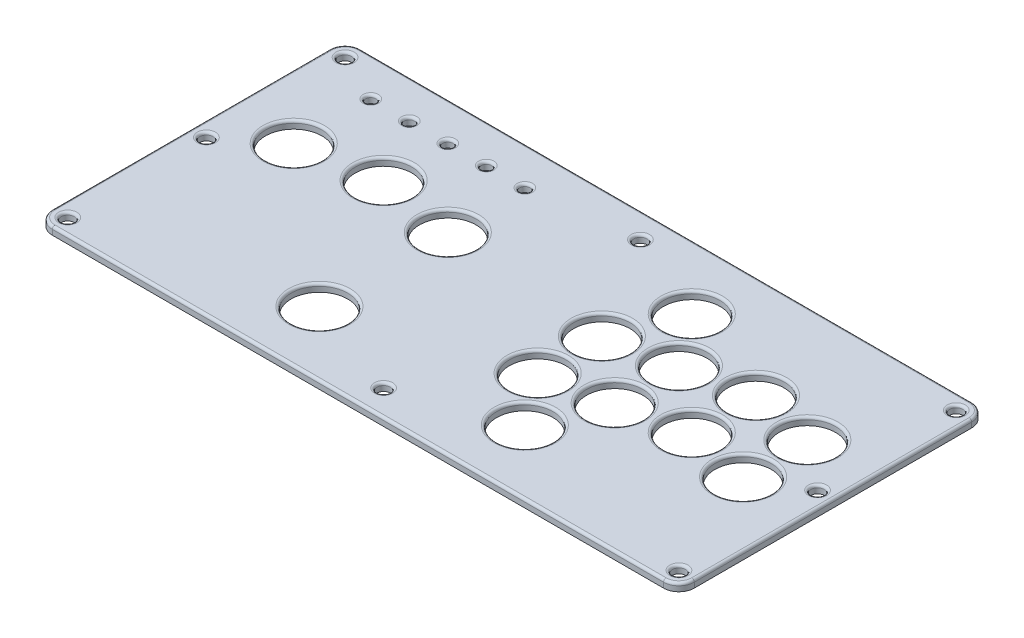
from build123d import *

# Parameters (mm, degrees)
SKETCH_1_R      = 2.55
SKETCH_1_R_2    = 11
SKETCH_1_R_3    = 2
EXTRUDE_1_DEPTH = 3
FILLET_1_R      = 1


with BuildPart() as part:
    # 草图1 → 凸台-拉伸1 (new body)
    with BuildSketch(Plane(origin=(0, 0, 0), x_dir=(1, 0, 0), z_dir=(0, 1, 0))):
        with BuildLine():
            Line((18.99899992, 127.363794239), (256.99899992, 127.363794239))
            ThreePointArc((256.99899992, 127.363794239), (261.241640607, 125.606434926), (262.99899992, 121.363794239))
            Line((262.99899992, 121.363794239), (262.99899992, 13.363794239))
            ThreePointArc((262.99899992, 13.363794239), (261.241640607, 9.121153552), (256.99899992, 7.363794239))
            Line((256.99899992, 7.363794239), (18.99899992, 7.363794239))
            ThreePointArc((18.99899992, 7.363794239), (14.756359233, 9.121153552), (12.99899992, 13.363794239))
            Line((12.99899992, 13.363794239), (12.99899992, 121.363794239))
            ThreePointArc((12.99899992, 121.363794239), (14.756359233, 125.606434926), (18.99899992, 127.363794239))
        make_face()
        with Locations(Location((18.99899992, 121.363794239, 0), (0, 0, 270))):
            Circle(SKETCH_1_R, mode=Mode.SUBTRACT)
        with Locations(Location((256.99899992, 121.363794239, 0), (0, 0, 270))):
            Circle(SKETCH_1_R, mode=Mode.SUBTRACT)
        with Locations(Location((137.99899992, 117.363794239, 0), (0, 0, 270))):
            Circle(SKETCH_1_R, mode=Mode.SUBTRACT)
        with Locations(Location((18.99899992, 13.363794239, 0), (0, 0, 270))):
            Circle(SKETCH_1_R, mode=Mode.SUBTRACT)
        with Locations(Location((256.99899992, 13.363794239, 0), (0, 0, 270))):
            Circle(SKETCH_1_R, mode=Mode.SUBTRACT)
        with Locations(Location((137.99899992, 17.363794239, 0), (0, 0, 270))):
            Circle(SKETCH_1_R, mode=Mode.SUBTRACT)
        with Locations(Location((256.99899992, 67.363794239, 0), (0, 0, 270))):
            Circle(SKETCH_1_R, mode=Mode.SUBTRACT)
        with Locations(Location((18.99899992, 67.363794239, 0), (0, 0, 270))):
            Circle(SKETCH_1_R, mode=Mode.SUBTRACT)
        with Locations(Location((162.99899992, 77.363794239, 0), (0, 0, 270))):
            Circle(SKETCH_1_R_2, mode=Mode.SUBTRACT)
        with Locations(Location((187.99899992, 82.363794239, 0), (0, 0, 270))):
            Circle(SKETCH_1_R_2, mode=Mode.SUBTRACT)
        with Locations(Location((212.99899992, 87.363794239, 0), (0, 0, 270))):
            Circle(SKETCH_1_R_2, mode=Mode.SUBTRACT)
        with Locations(Location((237.99899992, 82.363794239, 0), (0, 0, 270))):
            Circle(SKETCH_1_R_2, mode=Mode.SUBTRACT)
        with Locations(Location((162.99899992, 52.363794239, 0), (0, 0, 270))):
            Circle(SKETCH_1_R_2, mode=Mode.SUBTRACT)
        with Locations(Location((187.99899992, 57.363794239, 0), (0, 0, 270))):
            Circle(SKETCH_1_R_2, mode=Mode.SUBTRACT)
        with Locations(Location((212.99899992, 62.363794239, 0), (0, 0, 270))):
            Circle(SKETCH_1_R_2, mode=Mode.SUBTRACT)
        with Locations(Location((237.99899992, 57.363794239, 0), (0, 0, 270))):
            Circle(SKETCH_1_R_2, mode=Mode.SUBTRACT)
        with Locations(Location((172.99899992, 102.363794239, 0), (0, 0, 270))):
            Circle(SKETCH_1_R_2, mode=Mode.SUBTRACT)
        with Locations(Location((177.99899992, 32.363794239, 0), (0, 0, 270))):
            Circle(SKETCH_1_R_2, mode=Mode.SUBTRACT)
        with Locations(Location((97.99899992, 82.363794239, 0), (0, 0, 270))):
            Circle(SKETCH_1_R_2, mode=Mode.SUBTRACT)
        with Locations(Location((67.99899992, 87.363794239, 0), (0, 0, 270))):
            Circle(SKETCH_1_R_2, mode=Mode.SUBTRACT)
        with Locations(Location((37.99899992, 82.363794239, 0), (0, 0, 270))):
            Circle(SKETCH_1_R_2, mode=Mode.SUBTRACT)
        with Locations(Location((97.99899992, 32.363794239, 0), (0, 0, 270))):
            Circle(SKETCH_1_R_2, mode=Mode.SUBTRACT)
        with Locations(Location((37.99899992, 112.363794239, 0), (0, 0, 270))):
            Circle(SKETCH_1_R_3, mode=Mode.SUBTRACT)
        with Locations(Location((52.99899992, 112.363794239, 0), (0, 0, 270))):
            Circle(SKETCH_1_R_3, mode=Mode.SUBTRACT)
        with Locations(Location((67.99899992, 112.363794239, 0), (0, 0, 270))):
            Circle(SKETCH_1_R_3, mode=Mode.SUBTRACT)
        with Locations(Location((82.99899992, 112.363794239, 0), (0, 0, 270))):
            Circle(SKETCH_1_R_3, mode=Mode.SUBTRACT)
        with Locations(Location((97.99899992, 112.363794239, 0), (0, 0, 270))):
            Circle(SKETCH_1_R_3, mode=Mode.SUBTRACT)
    extrude(amount=EXTRUDE_1_DEPTH)

    # 圆角1
    fillet_1_edges = [part.edges().sort_by_distance(p)[0] for p in [
        (97.99899992, 3, -43.363794239),
        (37.99899992, 3, -114.363794239),
        (52.99899992, 3, -114.363794239),
        (67.99899992, 3, -114.363794239),
        (82.99899992, 3, -114.363794239),
        (97.99899992, 3, -114.363794239),
        (14.756359233, 3, -9.121153552),
        (137.99899992, 3, -7.363794239),
        (261.241640607, 3, -9.121153552),
        (18.99899992, 3, -123.913794239),
        (262.99899992, 3, -67.363794239),
        (256.99899992, 3, -123.913794239),
        (261.241640607, 3, -125.606434926),
        (137.99899992, 3, -119.913794239),
        (137.99899992, 3, -127.363794239),
        (18.99899992, 3, -15.913794239),
        (256.99899992, 3, -15.913794239),
        (137.99899992, 3, -19.913794239),
        (256.99899992, 3, -69.913794239),
        (18.99899992, 3, -69.913794239),
        (14.756359233, 3, -125.606434926),
        (162.99899992, 3, -88.363794239),
        (187.99899992, 3, -93.363794239),
        (212.99899992, 3, -98.363794239),
        (237.99899992, 3, -93.363794239),
        (162.99899992, 3, -63.363794239),
        (187.99899992, 3, -68.363794239),
        (212.99899992, 3, -73.363794239),
        (237.99899992, 3, -68.363794239),
        (172.99899992, 3, -113.363794239),
        (177.99899992, 3, -43.363794239),
        (12.99899992, 3, -67.363794239),
        (97.99899992, 3, -93.363794239),
        (67.99899992, 3, -98.363794239),
        (37.99899992, 3, -93.363794239),
    ]]
    fillet(fillet_1_edges, radius=FILLET_1_R)


solid = part.part
